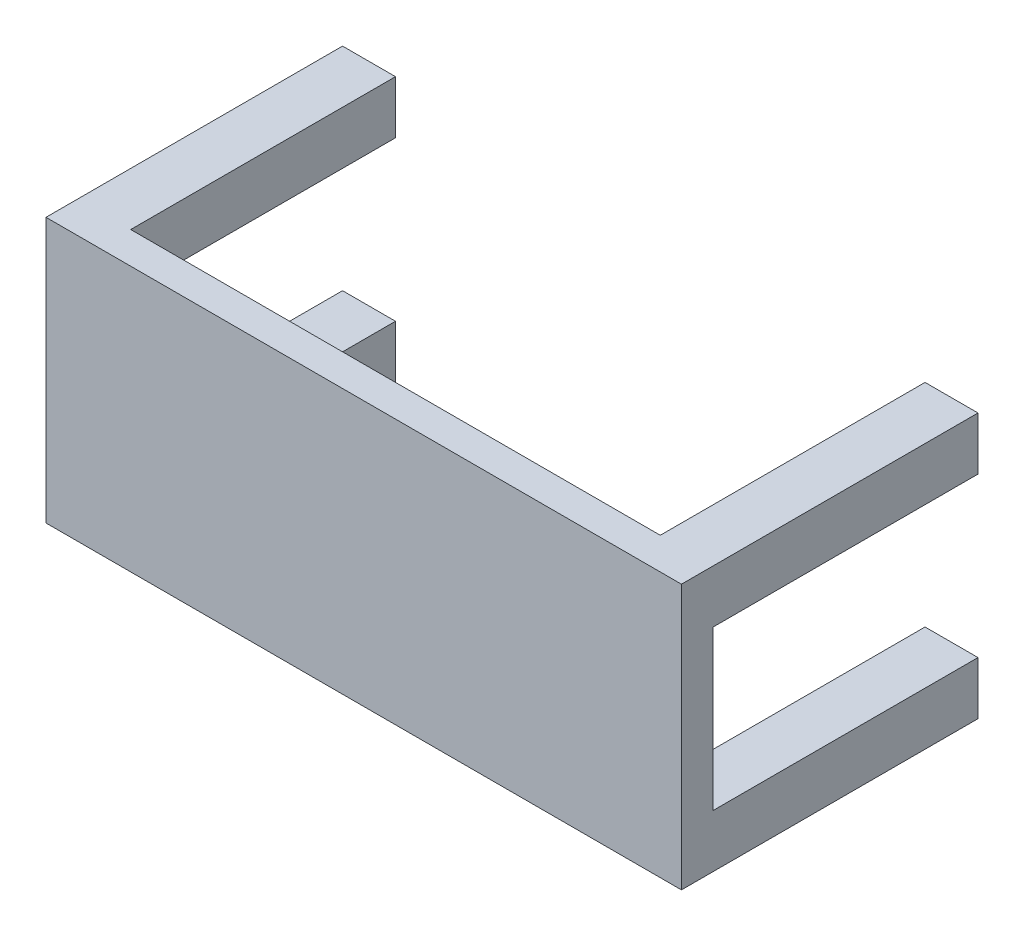
from build123d import *

# Parameters (mm, degrees)
BOSS_EXTRU_1_DEPTH      = 25
ESQUISSE2_W             = 25
ESQUISSE2_H             = 15
ENL_V_MAT_EXTRU_1_DEPTH = 106


with BuildPart() as part:
    # Esquisse1 → Boss.-Extru.1 (new body)
    with BuildSketch(Plane(origin=(0, 0, 0), x_dir=(1, 0, 0), z_dir=(0, 1, 0))):
        Polygon((36.864864865, -13.885135135), (36.864864865, 11.114864865), (41.864864865, 11.114864865), (41.864864865, -16.885135135), (36.864864865, -16.885135135), (-13.135135135, -16.885135135), (-18.135135135, -16.885135135), (-18.135135135, 11.114864865), (-13.135135135, 11.114864865), (-13.135135135, -13.885135135), align=None)
    extrude(amount=BOSS_EXTRU_1_DEPTH)

    # Esquisse2 → Enlèv. mat.-Extru.1 (cut)
    with BuildSketch(Plane(origin=(41.864864865, 0, 0), x_dir=(0, 0, -1), z_dir=(1, 0, 0))):
        with Locations((-1.385135135, 12.5)):
            Rectangle(ESQUISSE2_W, ESQUISSE2_H)
    extrude(amount=-ENL_V_MAT_EXTRU_1_DEPTH, mode=Mode.SUBTRACT)


solid = part.part
